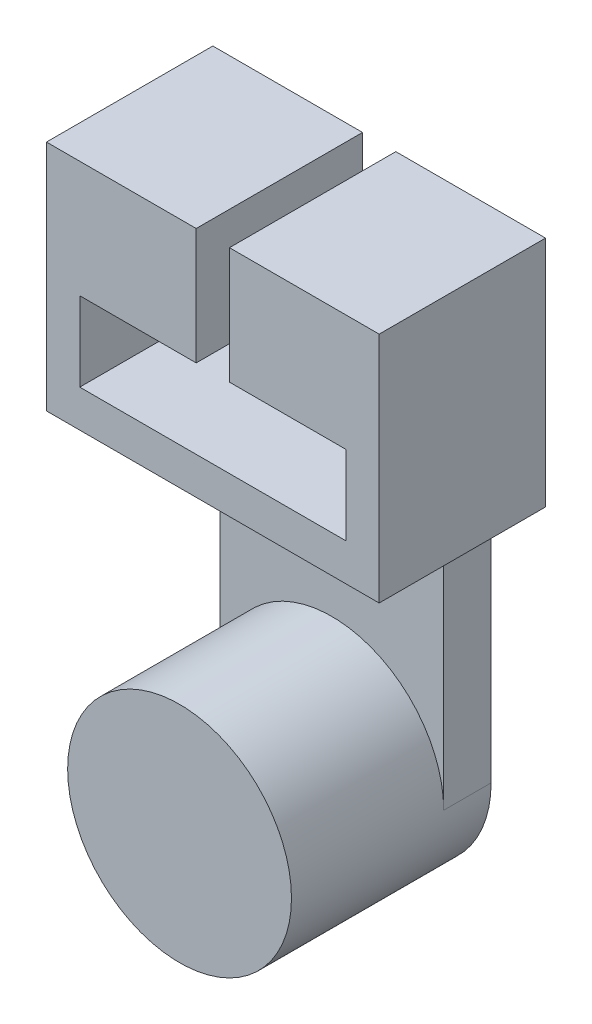
from build123d import *

# Parameters (mm, degrees)
SKETCH1_R           = 10.6807
BOSS_EXTRUDE1_DEPTH = 19.05
SKETCH2_W           = 21.3614
SKETCH2_H           = 25.4
BOSS_EXTRUDE2_DEPTH = 4.5212
BOSS_EXTRUDE3_DEPTH = 3.556
SKETCH4_W           = 15.875
SKETCH4_H           = 22.225
BOSS_EXTRUDE4_DEPTH = 3.175
SKETCH5_W           = 15.875
SKETCH5_H           = 22.225
BOSS_EXTRUDE5_DEPTH = 3.175
SKETCH7_W           = 15.875
SKETCH7_H           = 11.1125
BOSS_EXTRUDE6_DEPTH = 11.1125
SKETCH8_W           = 15.875
SKETCH8_H           = 11.1125
BOSS_EXTRUDE7_DEPTH = 11.1125


with BuildPart() as part:
    # Sketch1 → Boss-Extrude1 (new body)
    with BuildSketch(Plane.XY):
        with Locations(Location((0, 0, 0), (0, 0, 180))):
            Circle(SKETCH1_R)
    extrude(amount=BOSS_EXTRUDE1_DEPTH)

    # Sketch2 → Boss-Extrude2 (add)
    with BuildSketch(Plane(origin=(0, 0, 0), x_dir=(-1, 0, 0), z_dir=(0, 0, -1))):
        with Locations((0, 12.7)):
            Rectangle(SKETCH2_W, SKETCH2_H)
    extrude(amount=-BOSS_EXTRUDE2_DEPTH)

    # Sketch3 → Boss-Extrude3 (add)
    with BuildSketch(Plane(origin=(0, 25.4, 0), x_dir=(1, 0, 0), z_dir=(0, 1, 0))):
        Polygon((0, 0), (12.7, 0), (12.7, -15.875), (-12.7, -15.875), (-12.7, 0), align=None)
    extrude(amount=BOSS_EXTRUDE3_DEPTH)

    # Sketch4 → Boss-Extrude4 (add)
    with BuildSketch(Plane(origin=(12.7, 0, 0), x_dir=(0, 0, -1), z_dir=(1, 0, 0))):
        with Locations((-7.9375, 36.5125)):
            Rectangle(SKETCH4_W, SKETCH4_H)
    extrude(amount=BOSS_EXTRUDE4_DEPTH)

    # Sketch5 → Boss-Extrude5 (add)
    with BuildSketch(Plane.ZY.offset(12.7)):
        with Locations((7.9375, 36.5125)):
            Rectangle(SKETCH5_W, SKETCH5_H)
    extrude(amount=BOSS_EXTRUDE5_DEPTH)

    # Sketch7 → Boss-Extrude6 (add)
    with BuildSketch(Plane(origin=(-12.7, 0, 0), x_dir=(0, 0, -1), z_dir=(1, 0, 0))):
        with Locations((-7.9375, 42.06875)):
            Rectangle(SKETCH7_W, SKETCH7_H)
    extrude(amount=BOSS_EXTRUDE6_DEPTH)

    # Sketch8 → Boss-Extrude7 (add)
    with BuildSketch(Plane.ZY.offset(-12.7)):
        with Locations((7.9375, 42.06875)):
            Rectangle(SKETCH8_W, SKETCH8_H)
    extrude(amount=BOSS_EXTRUDE7_DEPTH)


solid = part.part
